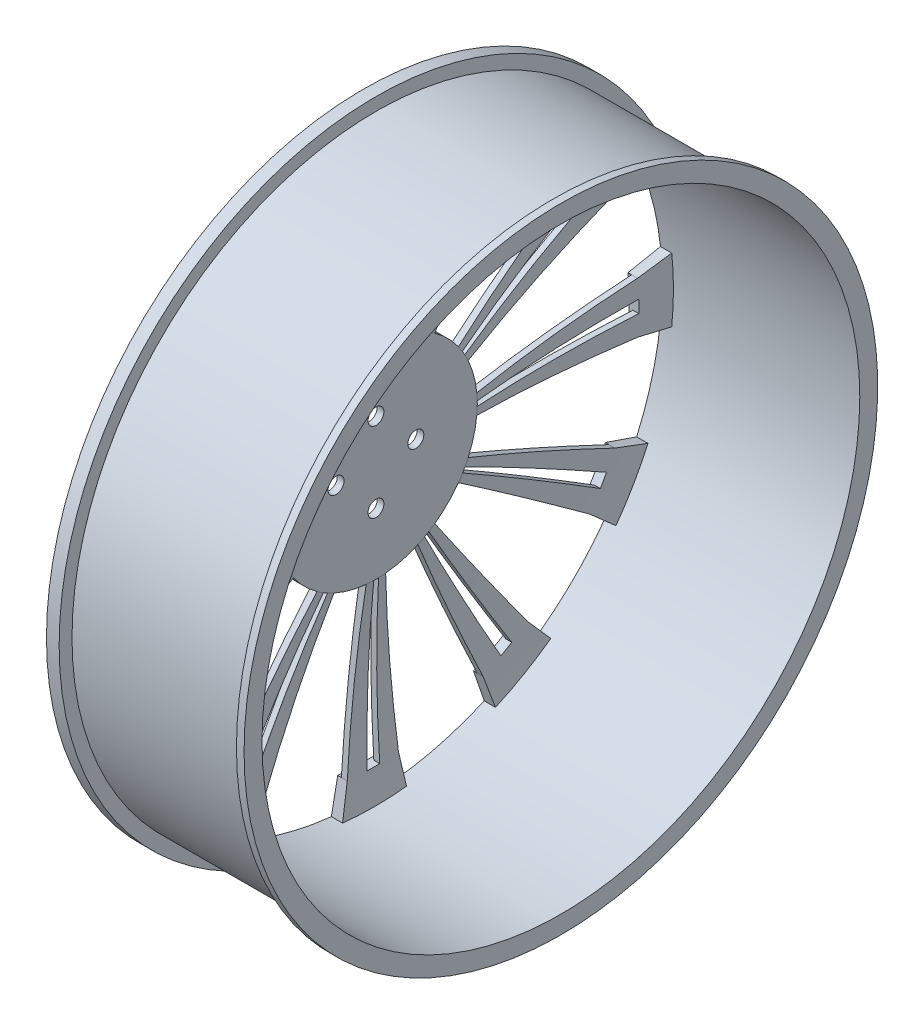
from build123d import *

# Parameters (mm, degrees)
BOSS_EXTRUDE1_START = 2.54
SKETCH2_R           = 158.8516
BOSS_EXTRUDE1_DEPTH = 2.54
CUT_EXTRUDE1_DEPTH  = 246.520967017
SKETCH4_R           = 4
CUT_EXTRUDE2_DEPTH  = 244.034193631


with BuildPart() as part:
    # Sketch1 → Revolve2 (revolve)
    with BuildSketch(Plane(origin=(0, 0, 0), x_dir=(1, 0, 0), z_dir=(0, 1, 0)), mode=Mode.PRIVATE) as revolve2_sk:
        with BuildLine():
            Line((-44.45, 152.4), (44.45, 152.4))
            Line((44.45, 152.4), (44.45, 158.8516))
            Line((44.45, 158.8516), (48.26, 158.8516))
            Line((48.26, 158.8516), (48.26, 149.86))
            Line((48.26, 149.86), (-45.165531021, 149.86))
            ThreePointArc((-45.165531021, 149.86), (-46.544994368, 100.317771353), (-44.465172572, 50.8))
            Line((-44.465172572, 50.8), (-44.465172572, 0))
            Line((-44.465172572, 0), (-47.864538021, 0))
            Line((-47.864538021, 0), (-47.864538021, 50.8))
            ThreePointArc((-47.864538021, 50.8), (-49.466489011, 100.324394149), (-48.26, 149.86))
            Line((-48.26, 149.86), (-48.26, 158.8516))
            Line((-48.26, 158.8516), (-44.45, 158.8516))
            Line((-44.45, 158.8516), (-44.45, 152.4))
        make_face()
    revolve(revolve2_sk.sketch.rotate(Axis((-44.45, 0, 0), (1, 0, 0)), 180), axis=Axis((-44.45, 0, 0), (1, 0, 0)))

    # Sketch2 → Boss-Extrude1 (add)
    with BuildSketch(Plane.ZY.offset(48.26).offset(BOSS_EXTRUDE1_START)):
        Circle(SKETCH2_R)
        with BuildLine():
            Line((-137.049620901, 60.625250605), (-121.361858858, 55.258679993))
            ThreePointArc((-121.361858858, 55.258679993), (-115.484487595, 66.675), (-108.536350082, 77.473112825))
            Line((-108.536350082, 77.473112825), (-121.027817585, 88.375827977))
            ThreePointArc((-121.027817585, 88.375827977), (-105.967022229, 105.967022229), (-88.375827977, 121.027817585))
            Line((-88.375827977, 121.027817585), (-77.473112825, 108.536350082))
            ThreePointArc((-77.473112825, 108.536350082), (-66.675, 115.484487595), (-55.258679993, 121.361858858))
            Line((-55.258679993, 121.361858858), (-60.625250605, 137.049620901))
            ThreePointArc((-60.625250605, 137.049620901), (-38.786622099, 144.753644328), (-16.021803316, 149.001078582))
            Line((-16.021803316, 149.001078582), (-12.825508776, 132.731792818))
            ThreePointArc((-12.825508776, 132.731792818), (0, 133.35), (12.825508776, 132.731792818))
            Line((12.825508776, 132.731792818), (16.021803316, 149.001078582))
            ThreePointArc((16.021803316, 149.001078582), (38.786622099, 144.753644328), (60.625250605, 137.049620901))
            Line((60.625250605, 137.049620901), (55.258679993, 121.361858858))
            ThreePointArc((55.258679993, 121.361858858), (66.675, 115.484487595), (77.473112825, 108.536350082))
            Line((77.473112825, 108.536350082), (88.375827977, 121.027817585))
            ThreePointArc((88.375827977, 121.027817585), (105.967022229, 105.967022229), (121.027817585, 88.375827977))
            Line((121.027817585, 88.375827977), (108.536350082, 77.473112825))
            ThreePointArc((108.536350082, 77.473112825), (115.484487595, 66.675), (121.361858858, 55.258679993))
            Line((121.361858858, 55.258679993), (137.049620901, 60.625250605))
            ThreePointArc((137.049620901, 60.625250605), (144.753644328, 38.786622099), (149.001078582, 16.021803316))
            Line((149.001078582, 16.021803316), (132.731792818, 12.825508776))
            ThreePointArc((132.731792818, 12.825508776), (133.35, 0), (132.731792818, -12.825508776))
            Line((132.731792818, -12.825508776), (149.001078582, -16.021803316))
            ThreePointArc((149.001078582, -16.021803316), (144.753644328, -38.786622099), (137.049620901, -60.625250605))
            Line((137.049620901, -60.625250605), (121.361858858, -55.258679993))
            ThreePointArc((121.361858858, -55.258679993), (115.484487595, -66.675), (108.536350082, -77.473112825))
            Line((108.536350082, -77.473112825), (121.027817585, -88.375827977))
            ThreePointArc((121.027817585, -88.375827977), (105.967022229, -105.967022229), (88.375827977, -121.027817585))
            Line((88.375827977, -121.027817585), (77.473112825, -108.536350082))
            ThreePointArc((77.473112825, -108.536350082), (66.675, -115.484487595), (55.258679993, -121.361858858))
            Line((55.258679993, -121.361858858), (60.625250605, -137.049620901))
            ThreePointArc((60.625250605, -137.049620901), (38.786622099, -144.753644328), (16.021803316, -149.001078582))
            Line((16.021803316, -149.001078582), (12.825508776, -132.731792818))
            ThreePointArc((12.825508776, -132.731792818), (0, -133.35), (-12.825508776, -132.731792818))
            Line((-12.825508776, -132.731792818), (-16.021803316, -149.001078582))
            ThreePointArc((-16.021803316, -149.001078582), (-38.786622099, -144.753644328), (-60.625250605, -137.049620901))
            Line((-60.625250605, -137.049620901), (-55.258679993, -121.361858858))
            ThreePointArc((-55.258679993, -121.361858858), (-66.675, -115.484487595), (-77.473112825, -108.536350082))
            Line((-77.473112825, -108.536350082), (-88.375827977, -121.027817585))
            ThreePointArc((-88.375827977, -121.027817585), (-105.967022229, -105.967022229), (-121.027817585, -88.375827977))
            Line((-121.027817585, -88.375827977), (-108.536350082, -77.473112825))
            ThreePointArc((-108.536350082, -77.473112825), (-115.484487595, -66.675), (-121.361858858, -55.258679993))
            Line((-121.361858858, -55.258679993), (-137.049620901, -60.625250605))
            ThreePointArc((-137.049620901, -60.625250605), (-144.753644328, -38.786622099), (-149.001078582, -16.021803316))
            Line((-149.001078582, -16.021803316), (-132.731792818, -12.825508776))
            ThreePointArc((-132.731792818, -12.825508776), (-133.35, 0), (-132.731792818, 12.825508776))
            Line((-132.731792818, 12.825508776), (-149.001078582, 16.021803316))
            ThreePointArc((-149.001078582, 16.021803316), (-144.753644328, 38.786622099), (-137.049620901, 60.625250605))
        make_face(mode=Mode.SUBTRACT)
    extrude(amount=-BOSS_EXTRUDE1_DEPTH)

    # Sketch3 → Cut-Extrude1 (cut, through all)
    with BuildSketch(Plane.ZY.offset(50.8)):
        with BuildLine():
            ThreePointArc((-50.564492502, -4.885908105), (-49.069031975, -13.148007491), (-46.233089089, -21.050925711))
            Line((-46.233089089, -21.050925711), (-121.361858858, -55.258679993))
            Line((-121.361858858, -55.258679993), (-137.049620901, -60.625250605))
            ThreePointArc((-137.049620901, -60.625250605), (-144.753644328, -38.786622099), (-149.001078582, -16.021803316))
            Line((-149.001078582, -16.021803316), (-132.731792818, -12.825508776))
            Line((-132.731792818, -12.825508776), (-50.564492502, -4.885908105))
        make_face()
        with BuildLine():
            ThreePointArc((-46.233089089, 21.050925711), (-49.069031975, 13.148007491), (-50.564492502, 4.885908105))
            Line((-50.564492502, 4.885908105), (-132.731792818, 12.825508776))
            Line((-132.731792818, 12.825508776), (-149.001078582, 16.021803316))
            ThreePointArc((-149.001078582, 16.021803316), (-144.753644328, 38.786622099), (-137.049620901, 60.625250605))
            Line((-137.049620901, 60.625250605), (-121.361858858, 55.258679993))
            Line((-121.361858858, 55.258679993), (-46.233089089, 21.050925711))
        make_face()
        with BuildLine():
            ThreePointArc((-29.513566791, 41.347180984), (-35.921024484, 35.921024484), (-41.347180984, 29.513566791))
            Line((-41.347180984, 29.513566791), (-108.536350082, 77.473112825))
            Line((-108.536350082, 77.473112825), (-121.027817585, 88.375827977))
            ThreePointArc((-121.027817585, 88.375827977), (-105.967022229, 105.967022229), (-88.375827977, 121.027817585))
            Line((-88.375827977, 121.027817585), (-77.473112825, 108.536350082))
            Line((-77.473112825, 108.536350082), (-29.513566791, 41.347180984))
        make_face()
        with BuildLine():
            ThreePointArc((-113.728840652, 69.627389036), (-115.34014459, 66.92438678), (-116.887218184, 64.184115832))
            Line((-116.887218184, 64.184115832), (-44.52846407, 24.451091745))
            ThreePointArc((-44.52846407, 24.451091745), (-43.939102701, 25.495004488), (-43.325272629, 26.524719633))
            Line((-43.325272629, 26.524719633), (-113.728840652, 69.627389036))
        make_face()
        with BuildLine():
            ThreePointArc((-4.885908105, 50.564492502), (-13.148007491, 49.069031975), (-21.050925711, 46.233089089))
            Line((-21.050925711, 46.233089089), (-55.258679993, 121.361858858))
            Line((-55.258679993, 121.361858858), (-60.625250605, 137.049620901))
            ThreePointArc((-60.625250605, 137.049620901), (-38.786622099, 144.753644328), (-16.021803316, 149.001078582))
            Line((-16.021803316, 149.001078582), (-12.825508776, 132.731792818))
            Line((-12.825508776, 132.731792818), (-4.885908105, 50.564492502))
        make_face()
        with BuildLine():
            ThreePointArc((21.050925711, 46.233089089), (13.148007491, 49.069031975), (4.885908105, 50.564492502))
            Line((4.885908105, 50.564492502), (12.825508776, 132.731792818))
            Line((12.825508776, 132.731792818), (16.021803316, 149.001078582))
            ThreePointArc((16.021803316, 149.001078582), (38.786622099, 144.753644328), (60.625250605, 137.049620901))
            Line((60.625250605, 137.049620901), (55.258679993, 121.361858858))
            Line((55.258679993, 121.361858858), (21.050925711, 46.233089089))
        make_face()
        with BuildLine():
            ThreePointArc((41.347180984, 29.513566791), (35.921024484, 35.921024484), (29.513566791, 41.347180984))
            Line((29.513566791, 41.347180984), (77.473112825, 108.536350082))
            Line((77.473112825, 108.536350082), (88.375827977, 121.027817585))
            ThreePointArc((88.375827977, 121.027817585), (105.967022229, 105.967022229), (121.027817585, 88.375827977))
            Line((121.027817585, 88.375827977), (108.536350082, 77.473112825))
            Line((108.536350082, 77.473112825), (41.347180984, 29.513566791))
        make_face()
        with BuildLine():
            ThreePointArc((50.564492502, 4.885908105), (49.069031975, 13.148007491), (46.233089089, 21.050925711))
            Line((46.233089089, 21.050925711), (121.361858858, 55.258679993))
            Line((121.361858858, 55.258679993), (137.049620901, 60.625250605))
            ThreePointArc((137.049620901, 60.625250605), (144.753644328, 38.786622099), (149.001078582, 16.021803316))
            Line((149.001078582, 16.021803316), (132.731792818, 12.825508776))
            Line((132.731792818, 12.825508776), (50.564492502, 4.885908105))
        make_face()
        with BuildLine():
            ThreePointArc((46.233089089, -21.050925711), (49.069031975, -13.148007491), (50.564492502, -4.885908105))
            Line((50.564492502, -4.885908105), (132.731792818, -12.825508776))
            Line((132.731792818, -12.825508776), (149.001078582, -16.021803316))
            ThreePointArc((149.001078582, -16.021803316), (144.753644328, -38.786622099), (137.049620901, -60.625250605))
            Line((137.049620901, -60.625250605), (121.361858858, -55.258679993))
            Line((121.361858858, -55.258679993), (46.233089089, -21.050925711))
        make_face()
        with BuildLine():
            ThreePointArc((29.513566791, -41.347180984), (35.921024484, -35.921024484), (41.347180984, -29.513566791))
            Line((41.347180984, -29.513566791), (108.536350082, -77.473112825))
            Line((108.536350082, -77.473112825), (121.027817585, -88.375827977))
            ThreePointArc((121.027817585, -88.375827977), (105.967022229, -105.967022229), (88.375827977, -121.027817585))
            Line((88.375827977, -121.027817585), (77.473112825, -108.536350082))
            Line((77.473112825, -108.536350082), (29.513566791, -41.347180984))
        make_face()
        with BuildLine():
            ThreePointArc((113.728840652, -69.627389036), (115.34014459, -66.92438678), (116.887218184, -64.184115832))
            Line((116.887218184, -64.184115832), (44.52846407, -24.451091745))
            ThreePointArc((44.52846407, -24.451091745), (43.939102701, -25.495004488), (43.325272629, -26.524719633))
            Line((43.325272629, -26.524719633), (113.728840652, -69.627389036))
        make_face()
        with BuildLine():
            ThreePointArc((4.885908105, -50.564492502), (13.148007491, -49.069031975), (21.050925711, -46.233089089))
            Line((21.050925711, -46.233089089), (55.258679993, -121.361858858))
            Line((55.258679993, -121.361858858), (60.625250605, -137.049620901))
            ThreePointArc((60.625250605, -137.049620901), (38.786622099, -144.753644328), (16.021803316, -149.001078582))
            Line((16.021803316, -149.001078582), (12.825508776, -132.731792818))
            Line((12.825508776, -132.731792818), (4.885908105, -50.564492502))
        make_face()
        with BuildLine():
            Line((-1.308444716, -50.783146539), (-3.434667378, -133.305759666))
            ThreePointArc((-3.434667378, -133.305759666), (-0.288146789, -133.349688681), (2.858534262, -133.319358241))
            Line((2.858534262, -133.319358241), (1.088965433, -50.788326949))
            ThreePointArc((1.088965433, -50.788326949), (-0.109770205, -50.799881402), (-1.308444716, -50.783146539))
        make_face()
        with BuildLine():
            ThreePointArc((-21.050925711, -46.233089089), (-13.148007491, -49.069031975), (-4.885908105, -50.564492502))
            Line((-4.885908105, -50.564492502), (-12.825508776, -132.731792818))
            Line((-12.825508776, -132.731792818), (-16.021803316, -149.001078582))
            ThreePointArc((-16.021803316, -149.001078582), (-38.786622099, -144.753644328), (-60.625250605, -137.049620901))
            Line((-60.625250605, -137.049620901), (-55.258679993, -121.361858858))
            Line((-55.258679993, -121.361858858), (-21.050925711, -46.233089089))
        make_face()
        with BuildLine():
            Line((-26.524719633, -43.325272629), (-69.627389036, -113.728840652))
            ThreePointArc((-69.627389036, -113.728840652), (-66.92438678, -115.34014459), (-64.184115832, -116.887218184))
            Line((-64.184115832, -116.887218184), (-24.451091745, -44.52846407))
            ThreePointArc((-24.451091745, -44.52846407), (-25.495004488, -43.939102701), (-26.524719633, -43.325272629))
        make_face()
        with BuildLine():
            ThreePointArc((-41.347180984, -29.513566791), (-35.921024484, -35.921024484), (-29.513566791, -41.347180984))
            Line((-29.513566791, -41.347180984), (-77.473112825, -108.536350082))
            Line((-77.473112825, -108.536350082), (-88.375827977, -121.027817585))
            ThreePointArc((-88.375827977, -121.027817585), (-105.967022229, -105.967022229), (-121.027817585, -88.375827977))
            Line((-121.027817585, -88.375827977), (-108.536350082, -77.473112825))
            Line((-108.536350082, -77.473112825), (-41.347180984, -29.513566791))
        make_face()
        with BuildLine():
            Line((-44.633717345, -24.258426907), (-117.16350803, -63.67837063))
            ThreePointArc((-117.16350803, -63.67837063), (-115.628291379, -66.425301901), (-114.028683922, -69.135242409))
            Line((-114.028683922, -69.135242409), (-43.439498637, -26.337235204))
            ThreePointArc((-43.439498637, -26.337235204), (-44.048872906, -25.304876915), (-44.633717345, -24.258426907))
        make_face()
        with BuildLine():
            Line((-50.783146539, 1.308444716), (-133.305759666, 3.434667378))
            ThreePointArc((-133.305759666, 3.434667378), (-133.349688681, 0.288146789), (-133.319358241, -2.858534262))
            Line((-133.319358241, -2.858534262), (-50.788326949, -1.088965433))
            ThreePointArc((-50.788326949, -1.088965433), (-50.799881402, 0.109770205), (-50.783146539, 1.308444716))
        make_face()
        with BuildLine():
            Line((-24.258426907, 44.633717345), (-63.67837063, 117.16350803))
            ThreePointArc((-63.67837063, 117.16350803), (-66.425301901, 115.628291379), (-69.135242409, 114.028683922))
            Line((-69.135242409, 114.028683922), (-26.337235204, 43.439498637))
            ThreePointArc((-26.337235204, 43.439498637), (-25.304876915, 44.048872906), (-24.258426907, 44.633717345))
        make_face()
        with BuildLine():
            Line((1.308444716, 50.783146539), (3.434667378, 133.305759666))
            ThreePointArc((3.434667378, 133.305759666), (0.288146789, 133.349688681), (-2.858534262, 133.319358241))
            Line((-2.858534262, 133.319358241), (-1.088965433, 50.788326949))
            ThreePointArc((-1.088965433, 50.788326949), (0.109770205, 50.799881402), (1.308444716, 50.783146539))
        make_face()
        with BuildLine():
            Line((26.524719633, 43.325272629), (69.627389036, 113.728840652))
            ThreePointArc((69.627389036, 113.728840652), (66.92438678, 115.34014459), (64.184115832, 116.887218184))
            Line((64.184115832, 116.887218184), (24.451091745, 44.52846407))
            ThreePointArc((24.451091745, 44.52846407), (25.495004488, 43.939102701), (26.524719633, 43.325272629))
        make_face()
        with BuildLine():
            Line((43.439498637, 26.337235204), (114.028683922, 69.135242409))
            ThreePointArc((114.028683922, 69.135242409), (115.628291379, 66.425301901), (117.16350803, 63.67837063))
            Line((117.16350803, 63.67837063), (44.633717345, 24.258426907))
            ThreePointArc((44.633717345, 24.258426907), (44.048872906, 25.304876915), (43.439498637, 26.337235204))
        make_face()
        with BuildLine():
            Line((50.783146539, -1.308444716), (133.305759666, -3.434667378))
            ThreePointArc((133.305759666, -3.434667378), (133.349688681, -0.288146789), (133.319358241, 2.858534262))
            Line((133.319358241, 2.858534262), (50.788326949, 1.088965433))
            ThreePointArc((50.788326949, 1.088965433), (50.799881402, -0.109770205), (50.783146539, -1.308444716))
        make_face()
        with BuildLine():
            Line((24.258426907, -44.633717345), (63.67837063, -117.16350803))
            ThreePointArc((63.67837063, -117.16350803), (66.425301901, -115.628291379), (69.135242409, -114.028683922))
            Line((69.135242409, -114.028683922), (26.337235204, -43.439498637))
            ThreePointArc((26.337235204, -43.439498637), (25.304876915, -44.048872906), (24.258426907, -44.633717345))
        make_face()
    extrude(amount=-CUT_EXTRUDE1_DEPTH, mode=Mode.SUBTRACT)

    # Sketch4 → Cut-Extrude2 (cut, through all)
    with BuildSketch(Plane(origin=(-44.465172572, 0, 0), x_dir=(0, 0, -1), z_dir=(1, 0, 0))):
        with Locations((0, -20)):
            Circle(SKETCH4_R)
        with Locations((20, 0)):
            Circle(SKETCH4_R)
        with Locations((0, 20)):
            Circle(SKETCH4_R)
        with Locations((-20, 0)):
            Circle(SKETCH4_R)
    extrude(amount=-CUT_EXTRUDE2_DEPTH, mode=Mode.SUBTRACT)


solid = part.part
